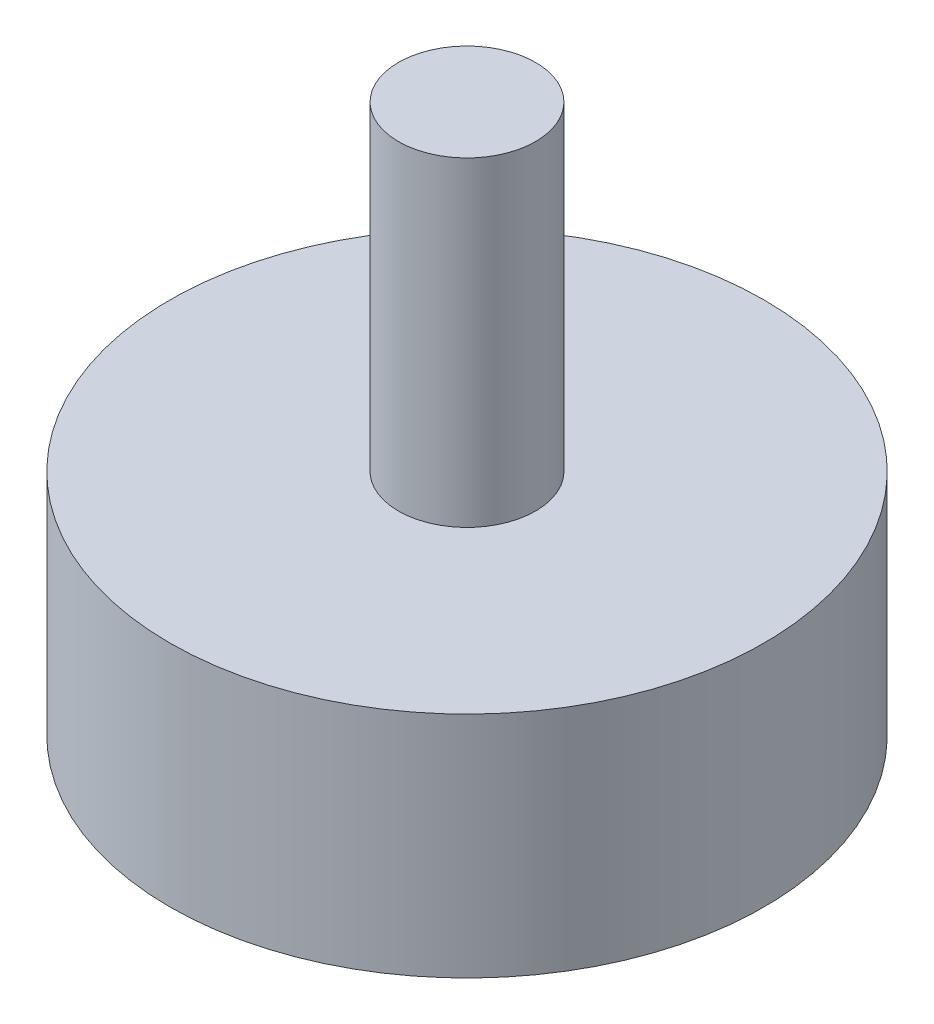
from build123d import *

# Parameters (mm, degrees)
SKIZZE1_R                       = 6.5
AUFSATZ_LINEAR_AUSTRAGEN1_DEPTH = 5
SKIZZE2_R                       = 1.5
AUFSATZ_LINEAR_AUSTRAGEN2_DEPTH = 7


with BuildPart() as part:
    # Skizze1 → Aufsatz-Linear austragen1 (new body)
    with BuildSketch(Plane(origin=(0, 0, 0), x_dir=(1, 0, 0), z_dir=(0, 1, 0))):
        with Locations(Location((0, 0, 0), (0, 0, 270))):
            Circle(SKIZZE1_R)
    extrude(amount=AUFSATZ_LINEAR_AUSTRAGEN1_DEPTH)

    # Skizze2 → Aufsatz-Linear austragen2 (add)
    with BuildSketch(Plane(origin=(0, 5, 0), x_dir=(1, 0, 0), z_dir=(0, 1, 0))):
        with Locations(Location((0, 0, 0), (0, 0, 270))):
            Circle(SKIZZE2_R)
    extrude(amount=AUFSATZ_LINEAR_AUSTRAGEN2_DEPTH)


solid = part.part
